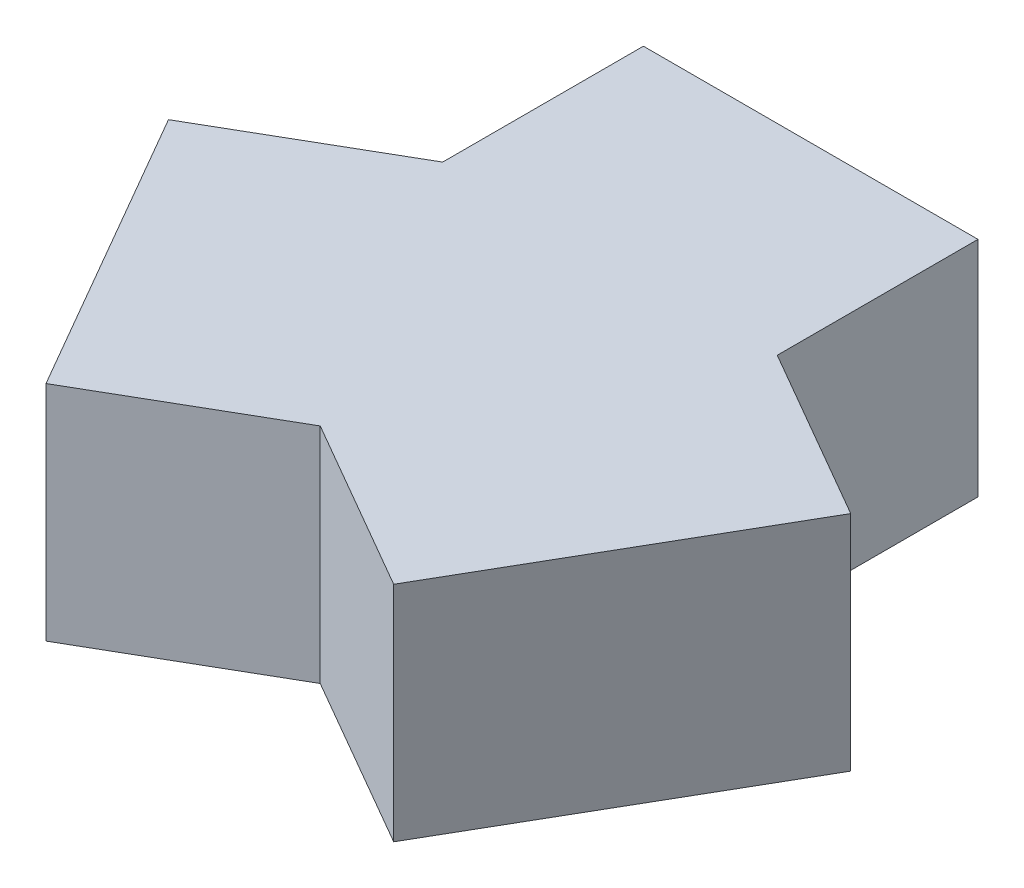
from build123d import *

# Parameters (mm, degrees)
BOSS_EXTRUDE1_DEPTH = 5


with BuildPart() as part:
    # Sketch1 → Boss-Extrude1 (new, symmetric)
    with BuildSketch(Plane(origin=(0, 0, 0), x_dir=(1, 0, 0), z_dir=(0, 1, 0))):
        Polygon((15.294228634, 0.5), (7.5, 5), (7.5, 14), (-7.5, 14), (-7.5, 5), (-15.294228634, 0.5), (-7.794228634, -12.490381057), (0, -7.990381057), (7.794228634, -12.490381057), align=None)
    extrude(amount=BOSS_EXTRUDE1_DEPTH, both=True)


solid = part.part
